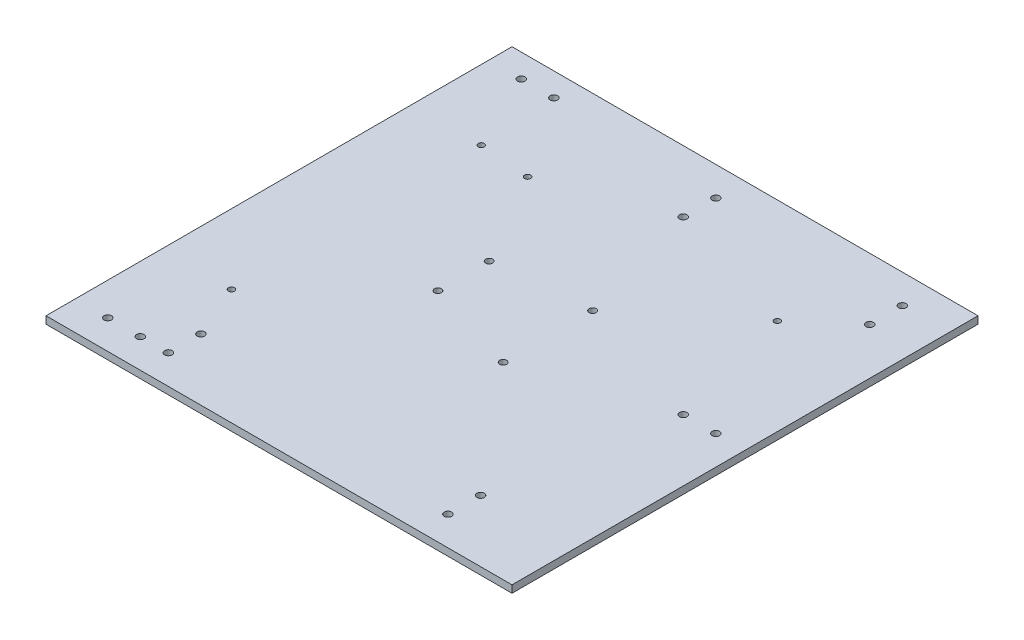
from build123d import *

# Parameters (mm, degrees)
SKETCH1_W           = 254
SKETCH1_H           = 254
SKETCH1_R           = 1.651
SKETCH1_R_2         = 2.032
SKETCH1_R_3         = 1.905
BOSS_EXTRUDE1_DEPTH = 4


with BuildPart() as part:
    # Sketch1 → Boss-Extrude1 (new body)
    with BuildSketch(Plane(origin=(0, 0, 0), x_dir=(1, 0, 0), z_dir=(0, 1, 0))):
        with Locations((127, 127)):
            Rectangle(SKETCH1_W, SKETCH1_H)
        with Locations(Location((201.803, 196.85, 0), (0, 0, 270))):
            Circle(SKETCH1_R, mode=Mode.SUBTRACT)
        with Locations(Location((65.659, 196.85, 0), (0, 0, 270))):
            Circle(SKETCH1_R, mode=Mode.SUBTRACT)
        with Locations(Location((38.1, 199.136, 0), (0, 0, 270))):
            Circle(SKETCH1_R, mode=Mode.SUBTRACT)
        with Locations(Location((220.345, 127, 0), (0, 0, 270))):
            Circle(SKETCH1_R_2, mode=Mode.SUBTRACT)
        with Locations(Location((238.125, 127, 0), (0, 0, 270))):
            Circle(SKETCH1_R_2, mode=Mode.SUBTRACT)
        with Locations(Location((50.8, 33.655, 0), (0, 0, 270))):
            Circle(SKETCH1_R_2, mode=Mode.SUBTRACT)
        with Locations(Location((50.8, 15.875, 0), (0, 0, 270))):
            Circle(SKETCH1_R_2, mode=Mode.SUBTRACT)
        with Locations(Location((228.6, 238.125, 0), (0, 0, 270))):
            Circle(SKETCH1_R_2, mode=Mode.SUBTRACT)
        with Locations(Location((228.6, 220.345, 0), (0, 0, 270))):
            Circle(SKETCH1_R_2, mode=Mode.SUBTRACT)
        with Locations(Location((94.996, 146.558, 0), (0, 0, 270))):
            Circle(SKETCH1_R_3, mode=Mode.SUBTRACT)
        with Locations(Location((94.996, 118.618, 0), (0, 0, 270))):
            Circle(SKETCH1_R_3, mode=Mode.SUBTRACT)
        with Locations(Location((146.558, 102.616, 0), (0, 0, 270))):
            Circle(SKETCH1_R_3, mode=Mode.SUBTRACT)
        with Locations(Location((146.558, 151.384, 0), (0, 0, 270))):
            Circle(SKETCH1_R_3, mode=Mode.SUBTRACT)
        with Locations(Location((38.1, 62.992, 0), (0, 0, 270))):
            Circle(SKETCH1_R, mode=Mode.SUBTRACT)
        with Locations(Location((203.2, 33.655, 0), (0, 0, 270))):
            Circle(SKETCH1_R_2, mode=Mode.SUBTRACT)
        with Locations(Location((203.2, 15.875, 0), (0, 0, 270))):
            Circle(SKETCH1_R_2, mode=Mode.SUBTRACT)
        with Locations(Location((127, 238.125, 0), (0, 0, 270))):
            Circle(SKETCH1_R_2, mode=Mode.SUBTRACT)
        with Locations(Location((127, 220.345, 0), (0, 0, 270))):
            Circle(SKETCH1_R_2, mode=Mode.SUBTRACT)
        with Locations(Location((35.56, 15.875, 0), (0, 0, 270))):
            Circle(SKETCH1_R_2, mode=Mode.SUBTRACT)
        with Locations(Location((17.78, 15.875, 0), (0, 0, 270))):
            Circle(SKETCH1_R_2, mode=Mode.SUBTRACT)
        with Locations(Location((17.78, 241.276758032, 0), (0, 0, 270))):
            Circle(SKETCH1_R_2, mode=Mode.SUBTRACT)
        with Locations(Location((35.56, 241.276758032, 0), (0, 0, 270))):
            Circle(SKETCH1_R_2, mode=Mode.SUBTRACT)
    extrude(amount=BOSS_EXTRUDE1_DEPTH)


solid = part.part
